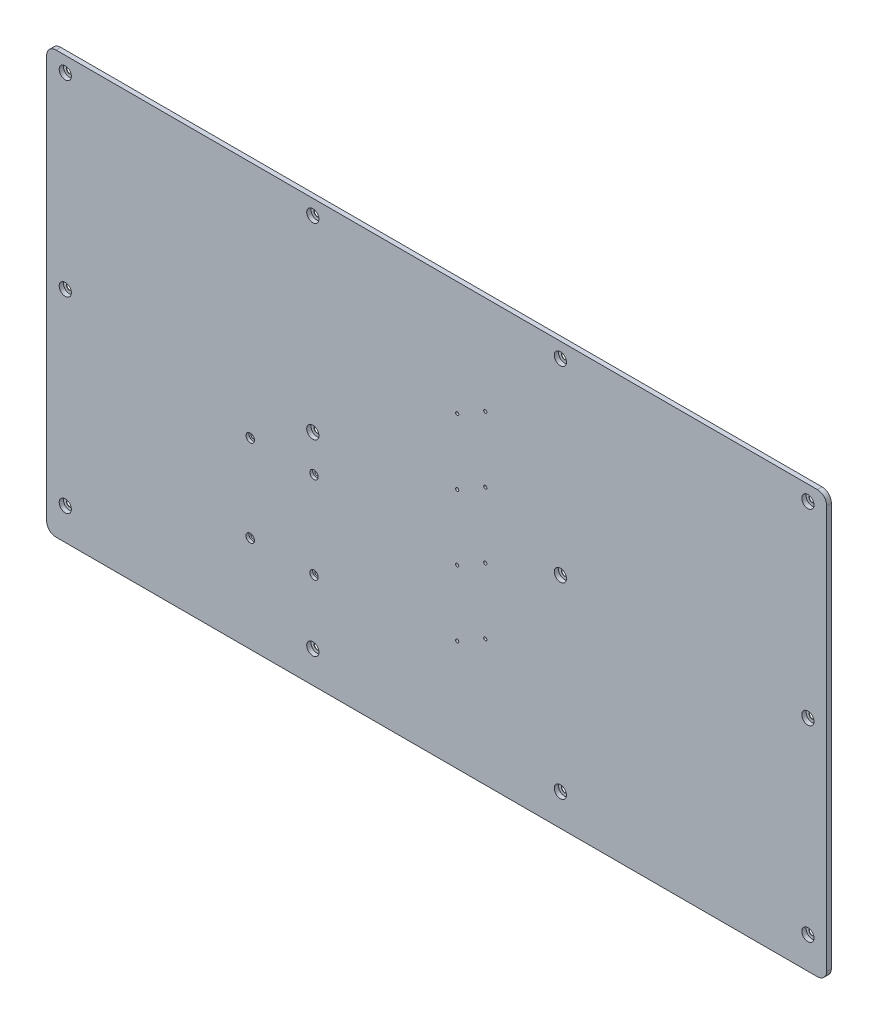
from build123d import *

# Parameters (mm, degrees)
BOSS_EXTRU_1_DEPTH                           = 5
D_GAGEMENT_M61_D                             = 6.6
R_P_TITION_LIN_AIRE1_COUNT                   = 5
R_P_TITION_LIN_AIRE1_PITCH                   = 100
R_P_TITION_LIN_AIRE1_COUNT_DIR2              = 4
R_P_TITION_LIN_AIRE1_PITCH_DIR2              = 264
CHAMBRAGE_POUR_VIS_T_TE_RONDE_BOMB_2_A_COUNT = 2
CHAMBRAGE_POUR_VIS_T_TE_RONDE_BOMB_2_A_PITCH = 92.544451502
R_P_TITION_LIN_AIRE3_COUNT                   = 2
R_P_TITION_LIN_AIRE3_PITCH                   = 68
M3_CLEARANCE_HOLE1_D                         = 3.4
LPATTERN1_COUNT                              = 4
LPATTERN1_PITCH                              = 70


with BuildPart() as part:
    # Esquisse1 → Boss.-Extru.1 (new body)
    with BuildSketch(Plane.XY):
        with BuildLine():
            Line((-406, -225), (406, -225))
            ThreePointArc((406, -225), (413.071067812, -222.071067812), (416, -215))
            Line((416, -215), (416, 215))
            ThreePointArc((416, 215), (413.071067812, 222.071067812), (406, 225))
            Line((406, 225), (-406, 225))
            ThreePointArc((-406, 225), (-413.071067812, 222.071067812), (-416, 215))
            Line((-416, 215), (-416, -215))
            ThreePointArc((-416, -215), (-413.071067812, -222.071067812), (-406, -225))
        make_face()
    extrude(amount=BOSS_EXTRU_1_DEPTH)

    # Dégagement M61 (through all)
    with Locations(Plane(origin=(0, 0, 0), x_dir=(-1, 0, 0), z_dir=(0, 0, -1))):
        with Locations((-395.919753935, 208.872368656)):
            Hole(D_GAGEMENT_M61_D / 2)

    # Esquisse4 → Chambrage pour vis _ t_te ronde bomb_e M (revolve, cut)
    with BuildSketch(Plane(origin=(395.919753935, 208.872368656, 5), x_dir=(0, -1, 0), z_dir=(1, 0, 0))):
        Polygon((0, 0), (0, 5), (3.3, 5), (3.3, 4.625), (3.325, 4.6), (6.5, 4.6), (6.5, 0), align=None)
    chambrage_pour_vis_t_te_ronde_bomb_e_m = revolve(axis=Axis((395.919753935, 208.872368656, 11.35), (0, 0, -1)), mode=Mode.SUBTRACT)

    # Répétition linéaire1: Chambrage pour vis _ t_te ronde bomb_e M 5 × 4, 8 skipped
    with Locations(*[(-j * R_P_TITION_LIN_AIRE1_PITCH_DIR2, -i * R_P_TITION_LIN_AIRE1_PITCH, 0) for i in range(R_P_TITION_LIN_AIRE1_COUNT) for j in range(R_P_TITION_LIN_AIRE1_COUNT_DIR2) if (i, j) not in ((0, 0), (1, 0), (1, 1), (1, 2), (1, 3), (3, 0), (3, 1), (3, 2), (3, 3))]):
        add(chambrage_pour_vis_t_te_ronde_bomb_e_m, mode=Mode.SUBTRACT)

    # Esquisse9 → Chambrage pour vis _ t_te ronde bomb 2 (revolve, cut)
    with BuildSketch(Plane(origin=(-130.81547906, -122.256295557, 5), x_dir=(0, -1, 0), z_dir=(1, 0, 0))):
        Polygon((0, 0), (0, 5), (2.25, 5), (2.25, 3.125), (2.275, 3.1), (4.5, 3.1), (4.5, 0), align=None)
    chambrage_pour_vis_t_te_ronde_bomb_2 = revolve(axis=Axis((-130.81547906, -122.256295557, 11.35), (0, 0, -1)), mode=Mode.SUBTRACT)

    # Chambrage pour vis _ t_te ronde bomb 2 a: Chambrage pour vis _ t_te ronde bomb 2 ×2
    with Locations(*[(0, i * CHAMBRAGE_POUR_VIS_T_TE_RONDE_BOMB_2_A_PITCH, 0) for i in range(1, CHAMBRAGE_POUR_VIS_T_TE_RONDE_BOMB_2_A_COUNT)]):
        add(chambrage_pour_vis_t_te_ronde_bomb_2, mode=Mode.SUBTRACT)

    # Répétition linéaire3: Chambrage pour vis _ t_te ronde bomb 2 ×2
    with Locations(*[(-i * R_P_TITION_LIN_AIRE3_PITCH, 0, 0) for i in range(1, R_P_TITION_LIN_AIRE3_COUNT)]):
        add(chambrage_pour_vis_t_te_ronde_bomb_2, mode=Mode.SUBTRACT)

    # Répétition linéaire3 copy 1 sketch → Répétition linéaire3 copy 1 (revolve, cut)
    with BuildSketch(Plane(origin=(-198.81547906, -29.711844055, 5), x_dir=(0, -1, 0), z_dir=(1, 0, 0))):
        Polygon((0, 0), (0, 5), (2.25, 5), (2.25, 3.125), (2.275, 3.1), (4.5, 3.1), (4.5, 0), align=None)
    revolve(axis=Axis((-198.81547906, -29.711844055, 11.35), (0, 0, -1)), mode=Mode.SUBTRACT)

    # M3 Clearance Hole1 (through all)
    with Locations(Plane.XY.offset(5)):
        with Locations((21.892110814, -106.913508058), (51.892110814, -89.913508058)):
            m3_clearance_hole1 = Hole(M3_CLEARANCE_HOLE1_D / 2)

    # LPattern1: M3 Clearance Hole1 ×4
    with Locations(*[(0, i * LPATTERN1_PITCH, 0) for i in range(1, LPATTERN1_COUNT)]):
        add(m3_clearance_hole1, mode=Mode.SUBTRACT)


solid = part.part
